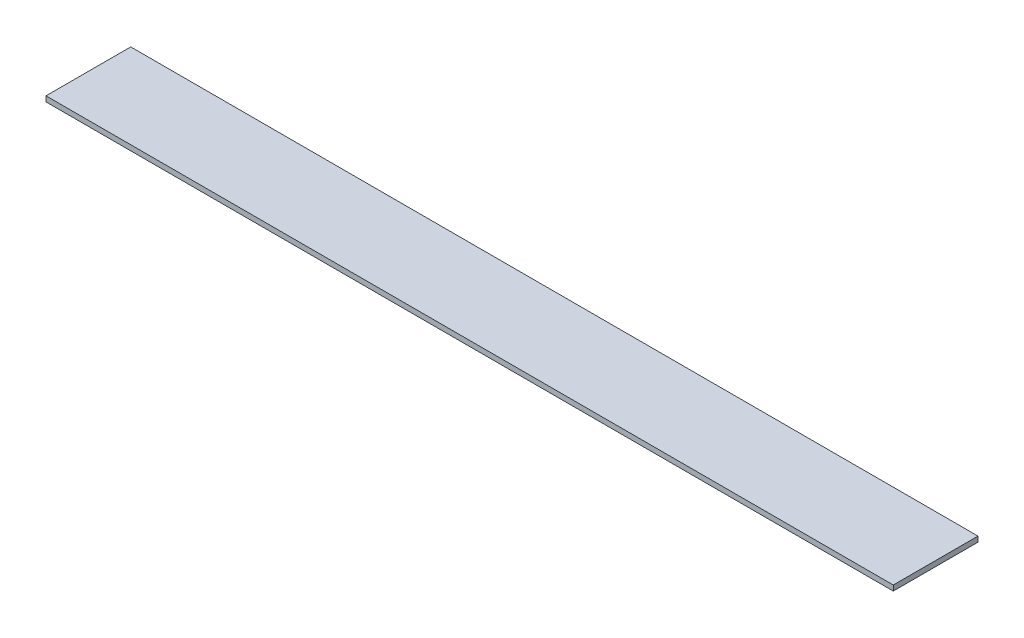
from build123d import *

# Parameters (mm, degrees)
SKETCH1_W           = 254
SKETCH1_H           = 25.4
BOSS_EXTRUDE1_DEPTH = 1.5875


with BuildPart() as part:
    # Sketch1 → Boss-Extrude1 (new body)
    with BuildSketch(Plane(origin=(0, 0, 0), x_dir=(1, 0, 0), z_dir=(0, 1, 0))):
        with Locations((127, 12.7)):
            Rectangle(SKETCH1_W, SKETCH1_H)
    extrude(amount=BOSS_EXTRUDE1_DEPTH)


solid = part.part
